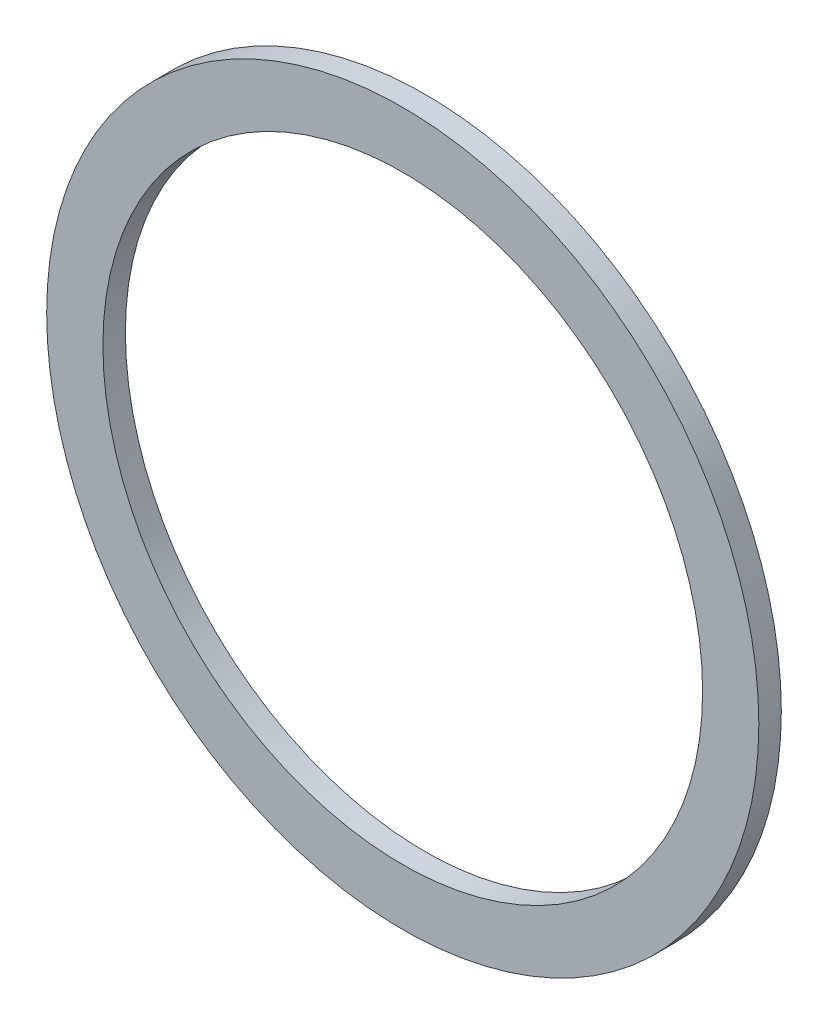
from build123d import *

# Parameters (mm, degrees)
EXTRUDE_START        = 303
EXTRUDE_SKETCH_1_R   = 95
EXTRUDE_SKETCH_1_R_2 = 80
EXTRUDE_1_DEPTH      = 6


with BuildPart() as part:
    # Extrude sketch 1 → Extrude 1 (new body)
    with BuildSketch(Plane.XY.offset(EXTRUDE_START)):
        with Locations((240, 0)):
            Circle(EXTRUDE_SKETCH_1_R)
        with Locations((240, 0)):
            Circle(EXTRUDE_SKETCH_1_R_2, mode=Mode.SUBTRACT)
    extrude(amount=EXTRUDE_1_DEPTH)


solid = part.part
